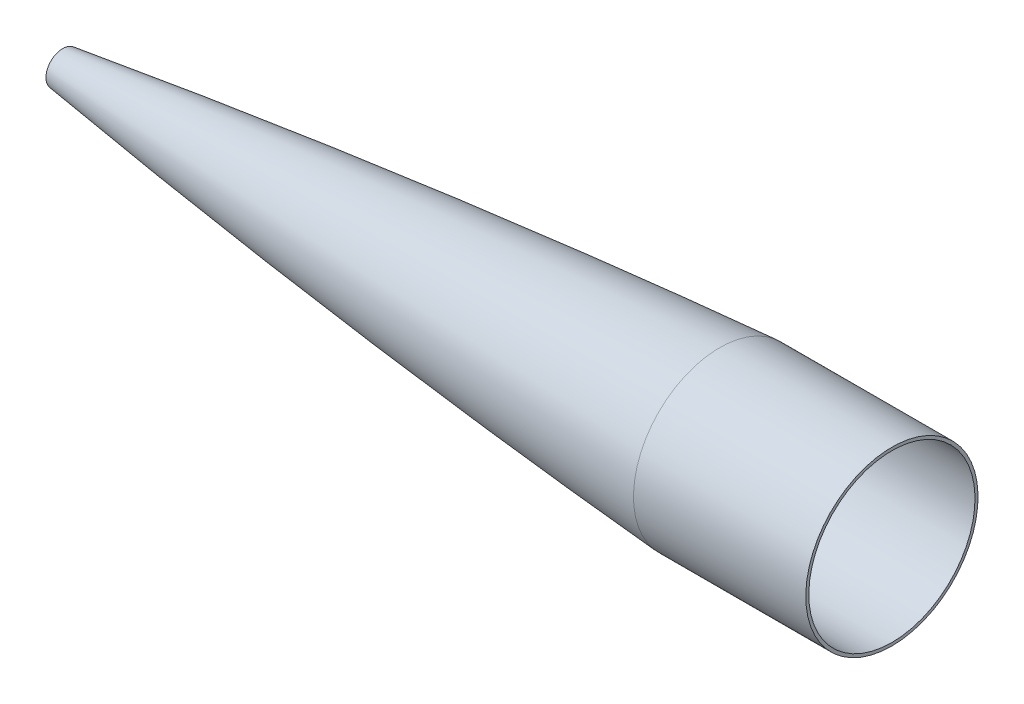
from build123d import *

# Parameters (mm, degrees)
CUT_EXTRUDE3_DEPTH = 250
SKETCH20_R         = 3
CUT_EXTRUDE4_DEPTH = 250
REVOLVE7_ANGLE     = 5
CIRPATTERN2_COUNT  = 14


with BuildPart() as part:
    # Sketch1 → Revolve1 (revolve)
    with BuildSketch(Plane(origin=(0, 0, 0), x_dir=(-1, 0, 0), z_dir=(0, 0, -1)), mode=Mode.PRIVATE) as revolve1_sk:
        with BuildLine():
            Line((-763.382394472, 85), (-763.235294117, 85))
            ThreePointArc((-763.235294117, 85), (-380.825050597, 49.616912867), (0, 0))
            Line((0, 0), (-22.46527886, 0))
            Line((-22.46527886, 0), (-22.46527886, 0.296477795))
            ThreePointArc((-22.46527886, 0.296477795), (-392.16587196, 47.855375712), (-763.345777049, 82))
            Line((-763.345777049, 82), (-763.382394472, 82))
            Line((-763.382394472, 82), (-763.382394472, 85))
        make_face()
    revolve(revolve1_sk.sketch.rotate(Axis((763.235294117, 0, 0), (-1, 0, 0)), 180), axis=Axis((763.235294117, 0, 0), (-1, 0, 0)))

    # Sketch14 → Revolve4 (revolve)
    with BuildSketch(Plane(origin=(0, 0, 0), x_dir=(-1, 0, 0), z_dir=(0, 0, -1)), mode=Mode.PRIVATE) as revolve4_sk:
        Polygon((-763.382394472, 85), (-933.235294117, 85), (-933.235294117, 82), (-763.235294117, 82), align=None)
    revolve(revolve4_sk.sketch.rotate(Axis((763.235294117, 0, 0), (1, 0, 0)), 180), axis=Axis((763.235294117, 0, 0), (1, 0, 0)))

    # Sketch18 → Cut-Extrude3 (cut, symmetric)
    with BuildSketch(Plane.XY):
        Polygon((-14.456340736, 18.501716749), (-14.456340736, -44.170271202), (115, -44.170271202), (115, 0), (115, 28.193165309), (-14.456340736, 28.193165309), align=None)
    extrude(amount=CUT_EXTRUDE3_DEPTH, both=True, mode=Mode.SUBTRACT)

    # Sketch19 → Revolve6 (revolve)
    with BuildSketch(Plane.XY, mode=Mode.PRIVATE) as revolve6_sk:
        Polygon((115, 16.506911496), (115, 0), (124.8, 0), (124.8, 17.505400014), align=None)
    revolve(revolve6_sk.sketch.rotate(Axis((115, 0, 0), (1, 0, 0)), 180), axis=Axis((115, 0, 0), (1, 0, 0)))

    # Sketch20 → Cut-Extrude4 (cut, symmetric)
    with BuildSketch(Plane.ZY.offset(-115)):
        Circle(SKETCH20_R)
    extrude(amount=CUT_EXTRUDE4_DEPTH, both=True, mode=Mode.SUBTRACT)

    # Sketch21 → Revolve7 (revolve)
    with BuildSketch(Plane.XY):
        with BuildLine():
            Line((763.235294117, 85), (763.603633258, 75))
            ThreePointArc((763.603633258, 75), (443.777305757, 46.376729418), (125, 7.78656595))
            Line((125, 7.78656595), (115, 7.044178147))
            Line((115, 7.044178147), (115, 16.506911496))
            ThreePointArc((115, 16.506911496), (438.575588607, 55.883629138), (763.235294117, 85))
        make_face()
    revolve7 = revolve(axis=Axis((115, 0, 0), (1, 0, 0)), revolution_arc=REVOLVE7_ANGLE)

    # CirPattern2: Revolve7 ×14 about axis
    cirpattern2_axis = Axis((0, 0, 0), (1, 0, 0))
    for i in range(1, CIRPATTERN2_COUNT):
        add(revolve7.rotate(cirpattern2_axis, i * 360 / CIRPATTERN2_COUNT))


solid = part.part
